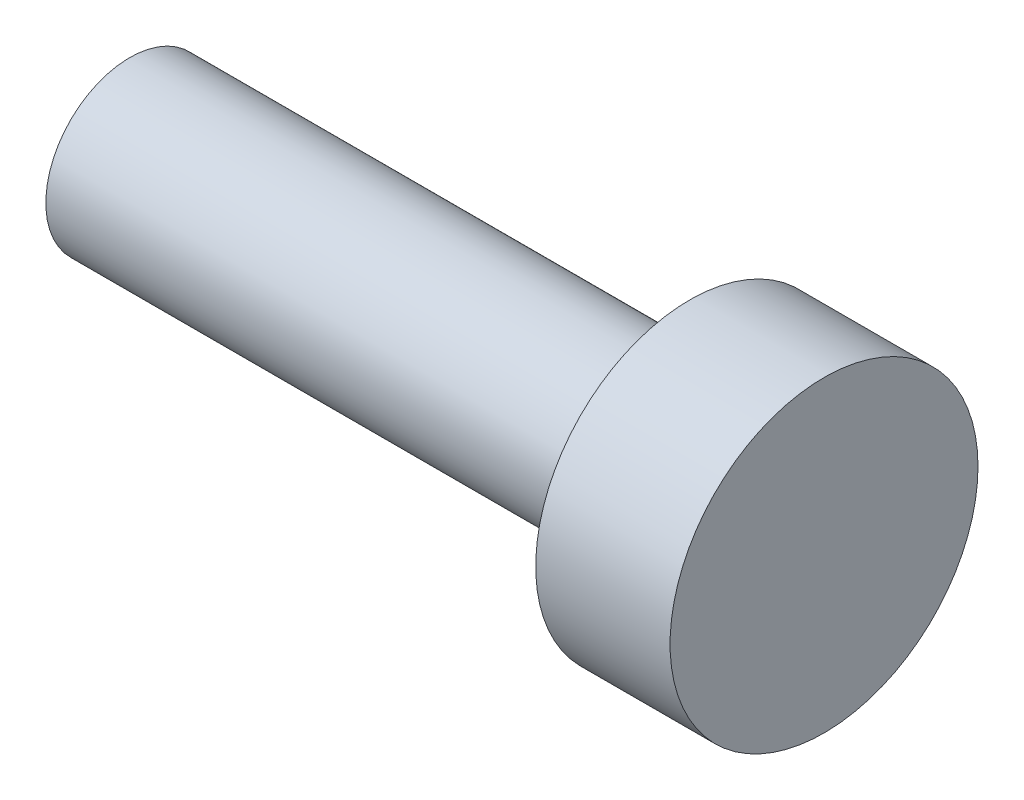
from build123d import *

# Parameters (mm, degrees)
M3_CLAMP_SHANK_SKETCH_R   = 1.5
M3_CLAMP_SHANK_DEPTH      = 10
CLAMP_SCREW_HEAD_SKETCH_R = 2.75
CLAMP_SCREW_HEAD_DEPTH    = 2.4


with BuildPart() as part:
    # M3 clamp shank sketch → M3 clamp shank (new body)
    with BuildSketch(Plane(origin=(44.708348754, 0, 0), x_dir=(0, 0, -1), z_dir=(1, 0, 0))):
        with Locations((12, -19)):
            Circle(M3_CLAMP_SHANK_SKETCH_R)
    extrude(amount=M3_CLAMP_SHANK_DEPTH)

    # Clamp screw head sketch → Clamp screw head (add)
    with BuildSketch(Plane(origin=(54.708348754, 0, 0), x_dir=(0, 0, -1), z_dir=(1, 0, 0))):
        with Locations((12, -19)):
            Circle(CLAMP_SCREW_HEAD_SKETCH_R)
    extrude(amount=CLAMP_SCREW_HEAD_DEPTH)


solid = part.part
